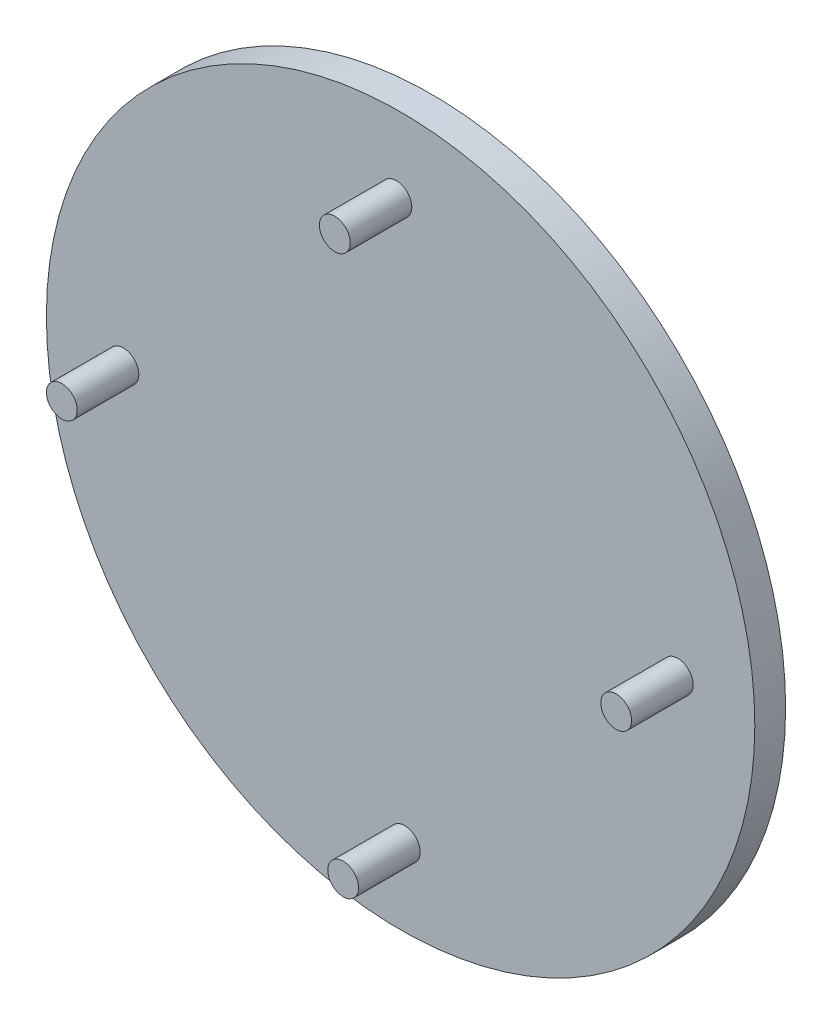
from build123d import *

# Parameters (mm, degrees)
SKETCH1_R           = 11.5
BOSS_EXTRUDE1_DEPTH = 1
SKETCH4_R           = 0.5
BOSS_EXTRUDE4_DEPTH = 2
CIRPATTERN3_COUNT   = 4


with BuildPart() as part:
    # Sketch1 → Boss-Extrude1 (new body)
    with BuildSketch(Plane.XY):
        with Locations((0, -0.253320711)):
            Circle(SKETCH1_R)
    extrude(amount=-BOSS_EXTRUDE1_DEPTH)

    # Sketch4 → Boss-Extrude4 (add)
    with BuildSketch(Plane.XY):
        with Locations((8.999235852, -0.117277767)):
            Circle(SKETCH4_R)
    boss_extrude4 = extrude(amount=BOSS_EXTRUDE4_DEPTH)

    # CirPattern3: Boss-Extrude4 ×4 about axis
    cirpattern3_axis = Axis((0, -0.253320711, 0), (0, 0, 1))
    for i in range(1, CIRPATTERN3_COUNT):
        add(boss_extrude4.rotate(cirpattern3_axis, i * 360 / CIRPATTERN3_COUNT))


solid = part.part
